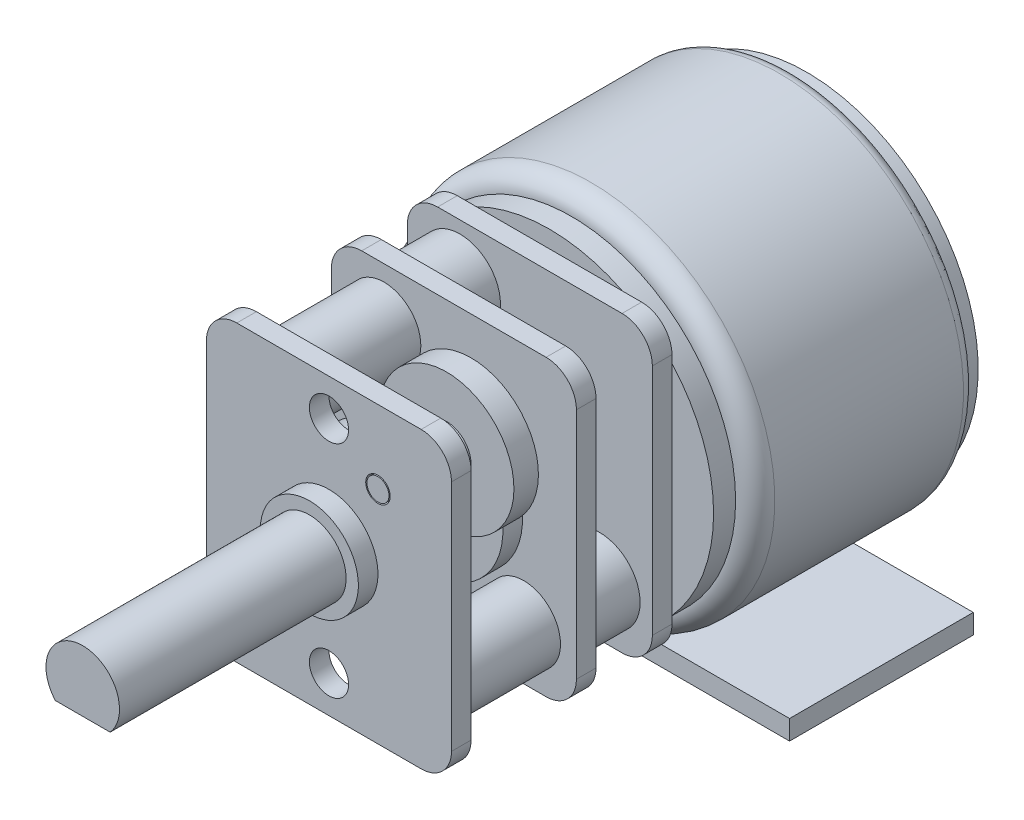
from build123d import *

# Parameters (mm, degrees)
SKETCH_2_OUTSIDE_W           = 24.52
SKETCH_2_OUTSIDE_H           = 24.52
CUT_EXTRUDE_1538_DEPTH       = 6.5
EXTRUDE_5_DEPTH              = 0.8
EXTRUDE_START                = 0.8
SKETCH_8_R                   = 0.8
SKETCH_8_R_2                 = 0.5
EXTRUDE_6_DEPTH              = 0.8
SKETCH_9_R                   = 1.65
EXTRUDE_7_DEPTH              = 2.3
EXTRUDE_8_DEPTH              = 0.8
EXTRUDE_9_REACH              = 21.113
SKETCH_11_R                  = 1.5
SKETCH_4_W                   = 11.5
SKETCH_4_H                   = 7.5
EXTRUDE_4965_DEPTH           = 0.8
SKETCH_5004_R                = 0.75
EXTRUDE_5452_DEPTH           = 0.7
EXTRUDE_5452_DRAFT           = 35
EXTRUDE_5452_PROFILE_2_DEPTH = 0.7
EXTRUDE_5452_PROFILE_2_DRAFT = 35
EXTRUDE_5452_PROFILE_3_DEPTH = 0.7
EXTRUDE_5452_PROFILE_3_DRAFT = 35
EXTRUDE_5452_PROFILE_4_DEPTH = 0.7
EXTRUDE_5452_PROFILE_4_DRAFT = 35
EXTRUDE_5452_PROFILE_5_DEPTH = 0.7
EXTRUDE_5452_PROFILE_5_DRAFT = 35
EXTRUDE_5452_PROFILE_6_DEPTH = 0.7
EXTRUDE_5452_PROFILE_6_DRAFT = 35
EXTRUDE_5452_PROFILE_7_DEPTH = 0.7
EXTRUDE_5452_PROFILE_7_DRAFT = 35
EXTRUDE_5452_PROFILE_8_DEPTH = 0.7
EXTRUDE_5452_PROFILE_8_DRAFT = 35
EXTRUDE_5761_DEPTH           = 0.01


with BuildPart() as part:
    # Эскиз1 → Motor (revolve)
    with BuildSketch(Plane(origin=(0, 0, 0), x_dir=(1, 0, 0), z_dir=(0, 1, 0))):
        with BuildLine():
            Line((0, 0), (-0.5, 0))
            ThreePointArc((-0.5, 0), (-0.676776695, -0.073223305), (-0.75, -0.25))
            Line((-0.75, -0.25), (-0.75, -0.5))
            Line((-0.75, -0.5), (-3, -0.5))
            Line((-3, -0.5), (-3, -1.5))
            Line((-3, -1.5), (-7, -1.5))
            Line((-7, -1.5), (-7, -2.1))
            ThreePointArc((-7, -2.1), (-7.353553391, -2.246446609), (-7.5, -2.6))
            Line((-7.5, -2.6), (-7.5, -10.3))
            ThreePointArc((-7.5, -10.3), (-7.265685425, -10.865685425), (-6.7, -11.1))
            Line((-6.7, -11.1), (-6.7, -12))
            Line((-6.7, -12), (-0.75, -12))
            Line((-0.75, -12), (0, -12))
            Line((0, -12), (0, 0))
        make_face()
        Polygon((0, -21), (-2, -21), (-2, -21.8), (-1.5, -21.8), (-1.5, -31.05), (0, -31.05), align=None)
    revolve(axis=Axis((0, 0, 0), (0, 0, 1)))

    # Эскиз2 outside → Cut-Extrude 1538 (cut)
    with BuildSketch(Plane.XY.offset(31.05)):
        Rectangle(SKETCH_2_OUTSIDE_W, SKETCH_2_OUTSIDE_H)
        with BuildLine():
            Line((-1.118033989, -1), (1.118033989, -1))
            ThreePointArc((1.118033989, -1), (0, 1.5), (-1.118033989, -1))
        make_face(mode=Mode.SUBTRACT)
    extrude(amount=-CUT_EXTRUDE_1538_DEPTH, mode=Mode.SUBTRACT)

    # Эскиз7 → Бобышка-Вытянуть5 (add)
    with BuildSketch(Plane.XY.offset(12)):
        with BuildLine():
            Line((3.762711015, 6), (-3.762711015, 6))
            ThreePointArc((-3.762711015, 6), (-4.637606447, 5.637606447), (-5, 4.762711015))
            Line((-5, 4.762711015), (-5, -4.762711015))
            ThreePointArc((-5, -4.762711015), (-4.637606447, -5.637606447), (-3.762711015, -6))
            Line((-3.762711015, -6), (3.762711015, -6))
            ThreePointArc((3.762711015, -6), (4.637606447, -5.637606447), (5, -4.762711015))
            Line((5, -4.762711015), (5, 4.762711015))
            ThreePointArc((5, 4.762711015), (4.637606447, 5.637606447), (3.762711015, 6))
        make_face()
    extrude(amount=EXTRUDE_5_DEPTH)

    # Эскиз8 → Бобышка-Вытянуть6 (add)
    with BuildSketch(Plane(origin=(0, 0, 21), x_dir=(-1, 0, 0), z_dir=(0, 0, -1)).offset(EXTRUDE_START)):
        with BuildLine():
            Line((3.762711015, 6), (-3.762711015, 6))
            ThreePointArc((-3.762711015, 6), (-4.637606447, 5.637606447), (-5, 4.762711015))
            Line((-5, 4.762711015), (-5, -4.762711015))
            ThreePointArc((-5, -4.762711015), (-4.637606447, -5.637606447), (-3.762711015, -6))
            Line((-3.762711015, -6), (3.762711015, -6))
            ThreePointArc((3.762711015, -6), (4.637606447, -5.637606447), (5, -4.762711015))
            Line((5, -4.762711015), (5, 4.762711015))
            ThreePointArc((5, 4.762711015), (4.637606447, 5.637606447), (3.762711015, 6))
        make_face()
        with Locations((0, -4.5)):
            Circle(SKETCH_8_R, mode=Mode.SUBTRACT)
        with Locations((0, 4.5)):
            Circle(SKETCH_8_R, mode=Mode.SUBTRACT)
        with Locations((2, -3)):
            Circle(SKETCH_8_R_2, mode=Mode.SUBTRACT)
        with Locations((-2, 3)):
            Circle(SKETCH_8_R_2, mode=Mode.SUBTRACT)
    extrude(amount=-EXTRUDE_6_DEPTH)

    # Эскиз9 → Бобышка-Вытянуть7 (add)
    with BuildSketch(Plane.XY.offset(12.8)):
        with Locations((2.85, -3.85)):
            Circle(SKETCH_9_R)
        with Locations((-2.85, 3.85)):
            Circle(SKETCH_9_R)
    extrude(amount=EXTRUDE_7_DEPTH)

    # Эскиз10 → Бобышка-Вытянуть8 (add)
    with BuildSketch(Plane.XY.offset(15.1)):
        with BuildLine():
            Line((3.762711015, 6), (-3.762711015, 6))
            ThreePointArc((-3.762711015, 6), (-4.637606447, 5.637606447), (-5, 4.762711015))
            Line((-5, 4.762711015), (-5, -0.262711015))
            ThreePointArc((-5, -0.262711015), (-4.637606447, -1.137606447), (-3.762711015, -1.5))
            Line((-3.762711015, -1.5), (-1.237288985, -1.5))
            ThreePointArc((-1.237288985, -1.5), (-0.362393553, -1.862393553), (0, -2.737288985))
            Line((0, -2.737288985), (0, -4.762711015))
            ThreePointArc((0, -4.762711015), (0.362393553, -5.637606447), (1.237288985, -6))
            Line((1.237288985, -6), (3.762711015, -6))
            ThreePointArc((3.762711015, -6), (4.637606447, -5.637606447), (5, -4.762711015))
            Line((5, -4.762711015), (5, 4.762711015))
            ThreePointArc((5, 4.762711015), (4.637606447, 5.637606447), (3.762711015, 6))
        make_face()
    extrude(amount=EXTRUDE_8_DEPTH)

    # Эскиз11 → Бобышка-Вытянуть9 (add, up to next)
    with BuildSketch(Plane.XY.offset(15.9), mode=Mode.PRIVATE) as extrude_9_sk1:
        with Locations(Location((2.85, -3.85, 0), (0, 0, 180))):
            Circle(SKETCH_11_R)
    extrude_9_tool1 = extrude(extrude_9_sk1.sketch, amount=EXTRUDE_9_REACH, mode=Mode.PRIVATE) - part.part
    # Эскиз11 → Бобышка-Вытянуть9 (add, up to next)
    with BuildSketch(Plane.XY.offset(15.9), mode=Mode.PRIVATE) as extrude_9_sk2:
        with Locations(Location((-2.85, 3.85, 0), (0, 0, 180))):
            Circle(SKETCH_11_R)
    extrude_9_tool2 = extrude(extrude_9_sk2.sketch, amount=EXTRUDE_9_REACH, mode=Mode.PRIVATE) - part.part
    add(extrude_9_tool1.solids().sort_by_distance((2.85, -3.85, 15.9))[0])
    add(extrude_9_tool2.solids().sort_by_distance((-2.85, 3.85, 15.9))[0])

    # Эскиз12 → Повернуть1 (revolve)
    with BuildSketch(Plane(origin=(0, 0, 0), x_dir=(1, 0, 0), z_dir=(0, 1, 0)), mode=Mode.PRIVATE) as revolve_1_sk:
        Polygon((0, -20.2), (-0.5, -20.2), (-0.5, -20), (-3, -20), (-3, -18.6), (-0.5, -18.6), (-0.5, -18.3), (-1.5, -18.3), (-1.5, -16.9), (-3, -16.9), (-3, -16.1), (-0.5, -16.1), (-0.5, -15.9), (0, -15.9), align=None)
        with BuildLine():
            Line((0, -12.8), (-0.75, -12.8))
            Line((-0.75, -12.8), (-0.75, -13))
            Line((-0.75, -13), (-1.5, -13))
            Line((-1.5, -13), (-1.5, -14))
            Line((-1.5, -14), (-0.75, -14))
            Line((-0.75, -14), (-0.75, -14.15))
            ThreePointArc((-0.75, -14.15), (-0.676776695, -14.326776695), (-0.5, -14.4))
            Line((-0.5, -14.4), (0, -14.4))
            Line((0, -14.4), (0, -12.8))
        make_face()
    revolve(revolve_1_sk.sketch.rotate(Axis((0, 0, 20.2), (0, 0, -1)), 180), axis=Axis((0, 0, 20.2), (0, 0, -1)))

    # Эскиз13 → Повернуть2 (revolve)
    with BuildSketch(Plane(origin=(0, 0, 0), x_dir=(0, 0, 1), z_dir=(-0.8320502943378438, 0.5547001962252291, 0)), mode=Mode.PRIVATE) as revolve_2_sk:
        Polygon((21, -3.605551275), (12.8, -3.605551275), (12.8, -3.304954271), (13, -3.304954271), (13, -0.855551275), (14, -0.855551275), (14, -2.605551275), (17.3, -2.605551275), (17.3, -3.155551275), (21, -3.155551275), align=None)
    revolve(revolve_2_sk.sketch.rotate(Axis((-2, -3, 21), (0, 0, 1)), 123.690067526), axis=Axis((-2, -3, 21), (0, 0, 1)))

    # Эскиз14 → Повернуть3 (revolve)
    with BuildSketch(Plane(origin=(0, 0, 0), x_dir=(0, 0, 1), z_dir=(-0.8320502943378438, 0.5547001962252291, 0)), mode=Mode.PRIVATE) as revolve_3_sk:
        Polygon((21, 3.605551275), (15.9, 3.605551275), (15.9, 3.105551275), (17.2, 3.105551275), (17.2, 0.855551275), (18.2, 0.855551275), (18.2, 2.605551275), (20, 2.605551275), (20, 3.155551275), (21, 3.155551275), align=None)
    revolve(revolve_3_sk.sketch.rotate(Axis((2, 3, 21), (0, 0, 1)), 303.690067526), axis=Axis((2, 3, 21), (0, 0, 1)))


with BuildPart() as body_2:
    # Эскиз4 → Extrude 4965 (new body)
    with BuildSketch(Plane(origin=(0, -7.5, 0), x_dir=(-1, 0, 0), z_dir=(0, -1, 0))):
        with Locations((-2.25, -6.45)):
            Rectangle(SKETCH_4_W, SKETCH_4_H)
    extrude(amount=EXTRUDE_4965_DEPTH)


with BuildPart() as extrude_5452_tool:
    # Sketch 5004 → Extrude 5452 (with draft: the straight prism first)
    with BuildSketch(Plane.XZ.offset(8.3)):
        with Locations((-2.25, 5.7)):
            Circle(SKETCH_5004_R)
    extrude(amount=EXTRUDE_5452_DEPTH)
    # Extrude 5452: the draft: its side faces are tilted about the plane it starts from
    extrude_5452_sides = [extrude_5452_tool.faces().sort_by_distance(p)[0] for p in [
        (-3, -8.65, 5.7),
    ]]
    draft(extrude_5452_sides, Plane.XZ.offset(8.3), EXTRUDE_5452_DRAFT)


with BuildPart() as body_2_1:
    add(body_2.part)

    # Extrude 5452: add extrude_5452_tool
    add(extrude_5452_tool.part)


with BuildPart() as extrude_5452_profile_2_tool:
    # Sketch 5004 → Extrude 5452 profile 2 (with draft: the straight prism first)
    with BuildSketch(Plane.XZ.offset(8.3)):
        with Locations((-0.75, 7.2)):
            Circle(SKETCH_5004_R)
    extrude(amount=EXTRUDE_5452_PROFILE_2_DEPTH)
    # Extrude 5452 profile 2: the draft: its side faces are tilted about the plane it starts from
    extrude_5452_profile_2_sides = [extrude_5452_profile_2_tool.faces().sort_by_distance(p)[0] for p in [
        (-1.5, -8.65, 7.2),
    ]]
    draft(extrude_5452_profile_2_sides, Plane.XZ.offset(8.3), EXTRUDE_5452_PROFILE_2_DRAFT)


with BuildPart() as body_2_2:
    add(body_2_1.part)

    # Extrude 5452 profile 2: add extrude_5452_profile_2_tool
    add(extrude_5452_profile_2_tool.part)


with BuildPart() as extrude_5452_profile_3_tool:
    # Sketch 5004 → Extrude 5452 profile 3 (with draft: the straight prism first)
    with BuildSketch(Plane.XZ.offset(8.3)):
        with Locations((0.75, 5.7)):
            Circle(SKETCH_5004_R)
    extrude(amount=EXTRUDE_5452_PROFILE_3_DEPTH)
    # Extrude 5452 profile 3: the draft: its side faces are tilted about the plane it starts from
    extrude_5452_profile_3_sides = [extrude_5452_profile_3_tool.faces().sort_by_distance(p)[0] for p in [
        (0, -8.65, 5.7),
    ]]
    draft(extrude_5452_profile_3_sides, Plane.XZ.offset(8.3), EXTRUDE_5452_PROFILE_3_DRAFT)


with BuildPart() as body_2_3:
    add(body_2_2.part)

    # Extrude 5452 profile 3: add extrude_5452_profile_3_tool
    add(extrude_5452_profile_3_tool.part)


with BuildPart() as extrude_5452_profile_4_tool:
    # Sketch 5004 → Extrude 5452 profile 4 (with draft: the straight prism first)
    with BuildSketch(Plane.XZ.offset(8.3)):
        with Locations((2.25, 7.2)):
            Circle(SKETCH_5004_R)
    extrude(amount=EXTRUDE_5452_PROFILE_4_DEPTH)
    # Extrude 5452 profile 4: the draft: its side faces are tilted about the plane it starts from
    extrude_5452_profile_4_sides = [extrude_5452_profile_4_tool.faces().sort_by_distance(p)[0] for p in [
        (1.5, -8.65, 7.2),
    ]]
    draft(extrude_5452_profile_4_sides, Plane.XZ.offset(8.3), EXTRUDE_5452_PROFILE_4_DRAFT)


with BuildPart() as body_2_4:
    add(body_2_3.part)

    # Extrude 5452 profile 4: add extrude_5452_profile_4_tool
    add(extrude_5452_profile_4_tool.part)


with BuildPart() as extrude_5452_profile_5_tool:
    # Sketch 5004 → Extrude 5452 profile 5 (with draft: the straight prism first)
    with BuildSketch(Plane.XZ.offset(8.3)):
        with Locations((7, 3.7)):
            Circle(SKETCH_5004_R)
    extrude(amount=EXTRUDE_5452_PROFILE_5_DEPTH)
    # Extrude 5452 profile 5: the draft: its side faces are tilted about the plane it starts from
    extrude_5452_profile_5_sides = [extrude_5452_profile_5_tool.faces().sort_by_distance(p)[0] for p in [
        (6.25, -8.65, 3.7),
    ]]
    draft(extrude_5452_profile_5_sides, Plane.XZ.offset(8.3), EXTRUDE_5452_PROFILE_5_DRAFT)


with BuildPart() as body_2_5:
    add(body_2_4.part)

    # Extrude 5452 profile 5: add extrude_5452_profile_5_tool
    add(extrude_5452_profile_5_tool.part)


with BuildPart() as extrude_5452_profile_6_tool:
    # Sketch 5004 → Extrude 5452 profile 6 (with draft: the straight prism first)
    with BuildSketch(Plane.XZ.offset(8.3)):
        with Locations((7, 5.533333333)):
            Circle(SKETCH_5004_R)
    extrude(amount=EXTRUDE_5452_PROFILE_6_DEPTH)
    # Extrude 5452 profile 6: the draft: its side faces are tilted about the plane it starts from
    extrude_5452_profile_6_sides = [extrude_5452_profile_6_tool.faces().sort_by_distance(p)[0] for p in [
        (6.25, -8.65, 5.533333333),
    ]]
    draft(extrude_5452_profile_6_sides, Plane.XZ.offset(8.3), EXTRUDE_5452_PROFILE_6_DRAFT)


with BuildPart() as body_2_6:
    add(body_2_5.part)

    # Extrude 5452 profile 6: add extrude_5452_profile_6_tool
    add(extrude_5452_profile_6_tool.part)


with BuildPart() as extrude_5452_profile_7_tool:
    # Sketch 5004 → Extrude 5452 profile 7 (with draft: the straight prism first)
    with BuildSketch(Plane.XZ.offset(8.3)):
        with Locations((7, 7.366666667)):
            Circle(SKETCH_5004_R)
    extrude(amount=EXTRUDE_5452_PROFILE_7_DEPTH)
    # Extrude 5452 profile 7: the draft: its side faces are tilted about the plane it starts from
    extrude_5452_profile_7_sides = [extrude_5452_profile_7_tool.faces().sort_by_distance(p)[0] for p in [
        (6.25, -8.65, 7.366666667),
    ]]
    draft(extrude_5452_profile_7_sides, Plane.XZ.offset(8.3), EXTRUDE_5452_PROFILE_7_DRAFT)


with BuildPart() as body_2_7:
    add(body_2_6.part)

    # Extrude 5452 profile 7: add extrude_5452_profile_7_tool
    add(extrude_5452_profile_7_tool.part)


with BuildPart() as extrude_5452_profile_8_tool:
    # Sketch 5004 → Extrude 5452 profile 8 (with draft: the straight prism first)
    with BuildSketch(Plane.XZ.offset(8.3)):
        with Locations((7, 9.2)):
            Circle(SKETCH_5004_R)
    extrude(amount=EXTRUDE_5452_PROFILE_8_DEPTH)
    # Extrude 5452 profile 8: the draft: its side faces are tilted about the plane it starts from
    extrude_5452_profile_8_sides = [extrude_5452_profile_8_tool.faces().sort_by_distance(p)[0] for p in [
        (6.25, -8.65, 9.2),
    ]]
    draft(extrude_5452_profile_8_sides, Plane.XZ.offset(8.3), EXTRUDE_5452_PROFILE_8_DRAFT)


with BuildPart() as body_2_8:
    add(body_2_7.part)

    # Extrude 5452 profile 8: add extrude_5452_profile_8_tool
    add(extrude_5452_profile_8_tool.part)

    # Эскиз6 → Extrude 5761 (add)
    # profile 1 of 16: a face of its own
    with BuildSketch(Plane.XZ.offset(8.3)):
        with BuildLine():
            Line((5.183226347, 9.305128205), (5.183226347, 9.228846154))
            add(Edge.make_bspline(
                [(5.183226347, 9.228846154), (5.173106274, 9.22934332), (5.153230721, 9.23031974), (5.124252058, 9.234892324), (5.096553035, 9.241435109), (5.070356056, 9.250685891), (5.045429488, 9.262174558), (5.021872342, 9.27595185), (4.999774482, 9.292270357), (4.979340763, 9.310777707), (4.96059521, 9.330878662), (4.944407508, 9.352567247), (4.930730359, 9.375358182), (4.919296343, 9.399182322), (4.910713809, 9.424308459), (4.904345697, 9.450508582), (4.900514298, 9.4778978), (4.900102465, 9.496558949), (4.899893013, 9.506049679)],
                knots=[0, 0, 0, 0, 1.10065271, 2.161652631, 3.183658789, 4.190468796, 5.17591951, 6.163126047, 7.15150782, 8.156236427, 9.156009102, 10.134482811, 11.092018607, 12.041330605, 13.001268258, 13.972401359, 14.968799086, 16, 16, 16, 16], degree=3))
            add(Edge.make_bspline(
                [(4.899893013, 9.506049679), (4.900109439, 9.515370725), (4.900534708, 9.533686246), (4.904241722, 9.560406313), (4.909922389, 9.585903666), (4.918340243, 9.609889343), (4.928902809, 9.632609504), (4.942038744, 9.653782836), (4.957126498, 9.673921332), (4.974923245, 9.69203663), (4.993912419, 9.708677717), (5.014192696, 9.723021328), (5.035163128, 9.735374158), (5.056987523, 9.745484564), (5.079736952, 9.753148701), (5.10319331, 9.758827092), (5.127627297, 9.762073168), (5.144167936, 9.762568621), (5.152577308, 9.762820513)],
                knots=[0, 0, 0, 0, 1.111674182, 2.184400057, 3.212814286, 4.223731311, 5.211378316, 6.196328225, 7.191884489, 8.207283132, 9.220262353, 10.201199469, 11.166417575, 12.120932471, 13.06540007, 14.026332106, 14.996573967, 16, 16, 16, 16], degree=3))
            add(Edge.make_bspline(
                [(5.152577308, 9.762820513), (5.164416063, 9.762409285), (5.187885819, 9.761594047), (5.222375218, 9.75462065), (5.255790478, 9.743728994), (5.282684739, 9.730616512), (5.304353679, 9.717384889), (5.322203622, 9.705473201), (5.341418154, 9.691449296), (5.362075046, 9.675432988), (5.383903778, 9.657148454), (5.407349714, 9.637070722), (5.431979324, 9.614681279), (5.448812639, 9.598980897), (5.457535241, 9.590845353)],
                knots=[0, 0, 0, 0, 1.184416499, 2.348048165, 3.509039915, 4.696071444, 5.333504901, 6.05069495, 6.844171097, 7.714965912, 8.667477798, 9.695072654, 10.805644396, 12, 12, 12, 12], degree=3))
            Line((5.457535241, 9.590845353), (5.684508398, 9.37817508))
            Line((5.684508398, 9.37817508), (5.684508398, 9.773717949))
            Line((5.684508398, 9.773717949), (5.771687885, 9.773717949))
            Line((5.771687885, 9.773717949), (5.771687885, 9.196153846))
            Line((5.771687885, 9.196153846), (5.419905033, 9.525801282))
            add(Edge.make_bspline(
                [(5.419905033, 9.525801282), (5.411526873, 9.533827197), (5.395434141, 9.549243338), (5.371939423, 9.571047678), (5.350143106, 9.590631433), (5.330086372, 9.608121371), (5.311475849, 9.623138079), (5.294914278, 9.636464193), (5.279673911, 9.647141551), (5.262008334, 9.658729575), (5.240439628, 9.669952971), (5.214081446, 9.6795974), (5.186947685, 9.685478149), (5.168611476, 9.686183609), (5.159388206, 9.686538462)],
                knots=[0, 0, 0, 0, 1.329631726, 2.553950428, 3.673215718, 4.687767853, 5.603093632, 6.413772471, 7.123043292, 7.734684054, 8.834405432, 9.900288307, 10.943827018, 12, 12, 12, 12], degree=3))
            add(Edge.make_bspline(
                [(5.159388206, 9.686538462), (5.153588438, 9.686384067), (5.142158208, 9.686079785), (5.125399667, 9.683394344), (5.109233926, 9.679336078), (5.093611262, 9.673520801), (5.078688746, 9.665844879), (5.064448215, 9.656501344), (5.050680895, 9.6457209), (5.037772237, 9.633249877), (5.025949658, 9.619549937), (5.015476666, 9.605077047), (5.006724311, 9.589764879), (4.999549462, 9.573677992), (4.993921155, 9.556861236), (4.990021214, 9.539282083), (4.987572611, 9.520989108), (4.987241312, 9.508498116), (4.987072501, 9.502133413)],
                knots=[0, 0, 0, 0, 0.991446411, 1.95395049, 2.89581595, 3.838931463, 4.798493298, 5.75982156, 6.748411868, 7.785213223, 8.824556874, 9.840280684, 10.836137867, 11.835679398, 12.848801643, 13.863922112, 14.911575587, 16, 16, 16, 16], degree=3))
            add(Edge.make_bspline(
                [(4.987072501, 9.502133413), (4.987239299, 9.495484543), (4.987566864, 9.482427259), (4.990048006, 9.463296967), (4.993809418, 9.444921487), (4.999783361, 9.427574998), (5.006841872, 9.410881872), (5.015808949, 9.395198482), (5.026228891, 9.380264435), (5.03831124, 9.366325367), (5.051886632, 9.353594562), (5.066847651, 9.342251598), (5.08308659, 9.332405907), (5.1005368, 9.323803635), (5.119372022, 9.316820921), (5.139521114, 9.311484355), (5.160897794, 9.307261899), (5.175659878, 9.305851249), (5.183226347, 9.305128205)],
                knots=[0, 0, 0, 0, 1.030878251, 2.024474673, 2.987898669, 3.934362936, 4.864849709, 5.795128259, 6.730474222, 7.685293701, 8.650606017, 9.611896181, 10.591709709, 11.591680886, 12.625074257, 13.701333388, 14.821793024, 16, 16, 16, 16], degree=3))
        make_face()
    # profile 2 of 16: a face of its own
    with BuildSketch(Plane.XZ.offset(8.3)):
        Polygon((4.921687885, 8.749358974), (5.771687885, 9.141666667), (5.771687885, 9.05874399), (5.499251988, 8.933082933), (5.499251988, 8.54775641), (5.771687885, 8.418519631), (5.771687885, 8.33525641), (4.921687885, 8.738461538), align=None)
        Polygon((5.087362965, 8.743058894), (5.412072501, 8.589132612), (5.412072501, 8.892898638), align=None, mode=Mode.SUBTRACT)
    # profile 3 of 16: a face of its own
    with BuildSketch(Plane.XZ.offset(8.3)):
        Polygon((4.921687885, 7.524248798), (4.921687885, 7.681410256), (5.771687885, 7.681410256), (5.771687885, 7.605128205), (5.008867372, 7.605128205), (5.008867372, 7.474358974), align=None)
    # profile 4 of 16: a face of its own
    with BuildSketch(Plane.XZ.offset(8.3)):
        Polygon((4.921687885, 6.896794872), (5.771687885, 7.289102564), (5.771687885, 7.206179888), (5.499251988, 7.08051883), (5.499251988, 6.695192308), (5.771687885, 6.565955529), (5.771687885, 6.482692308), (4.921687885, 6.885897436), align=None)
        Polygon((5.087362965, 6.890494792), (5.412072501, 6.73656851), (5.412072501, 7.040334535), align=None, mode=Mode.SUBTRACT)
    # profile 5 of 16: a face of its own
    with BuildSketch(Plane.XZ.offset(8.3)):
        with BuildLine():
            Line((5.183226347, 5.6), (5.183226347, 5.523717949))
            add(Edge.make_bspline(
                [(5.183226347, 5.523717949), (5.173106274, 5.524215114), (5.153230721, 5.525191535), (5.124252058, 5.529764119), (5.096553035, 5.536306904), (5.070356056, 5.545557685), (5.045429488, 5.557046353), (5.021872342, 5.570823645), (4.999774482, 5.587142152), (4.979340763, 5.605649501), (4.96059521, 5.625750457), (4.944407508, 5.647439042), (4.930730359, 5.670229977), (4.919296343, 5.694054117), (4.910713809, 5.719180254), (4.904345697, 5.745380376), (4.900514298, 5.772769595), (4.900102465, 5.791430743), (4.899893013, 5.800921474)],
                knots=[0, 0, 0, 0, 1.10065271, 2.161652631, 3.183658789, 4.190468796, 5.17591951, 6.163126047, 7.15150782, 8.156236427, 9.156009102, 10.134482811, 11.092018607, 12.041330605, 13.001268258, 13.972401359, 14.968799086, 16, 16, 16, 16], degree=3))
            add(Edge.make_bspline(
                [(4.899893013, 5.800921474), (4.900109439, 5.81024252), (4.900534708, 5.828558041), (4.904241722, 5.855278108), (4.909922389, 5.880775461), (4.918340243, 5.904761137), (4.928902809, 5.927481298), (4.942038744, 5.94865463), (4.957126498, 5.968793127), (4.974923245, 5.986908425), (4.993912419, 6.003549512), (5.014192696, 6.017893123), (5.035163128, 6.030245953), (5.056987523, 6.040356359), (5.079736952, 6.048020496), (5.10319331, 6.053698887), (5.127627297, 6.056944963), (5.144167936, 6.057440416), (5.152577308, 6.057692308)],
                knots=[0, 0, 0, 0, 1.111674182, 2.184400057, 3.212814286, 4.223731311, 5.211378316, 6.196328225, 7.191884489, 8.207283132, 9.220262353, 10.201199469, 11.166417575, 12.120932471, 13.06540007, 14.026332106, 14.996573967, 16, 16, 16, 16], degree=3))
            add(Edge.make_bspline(
                [(5.152577308, 6.057692308), (5.164416063, 6.05728108), (5.187885819, 6.056465842), (5.222375218, 6.049492445), (5.255790478, 6.038600789), (5.282684739, 6.025488307), (5.304353679, 6.012256684), (5.322203622, 6.000344996), (5.341418154, 5.986321091), (5.362075046, 5.970304783), (5.383903778, 5.952020248), (5.407349714, 5.931942517), (5.431979324, 5.909553074), (5.448812639, 5.893852692), (5.457535241, 5.885717147)],
                knots=[0, 0, 0, 0, 1.184416499, 2.348048165, 3.509039915, 4.696071444, 5.333504901, 6.05069495, 6.844171097, 7.714965912, 8.667477798, 9.695072654, 10.805644396, 12, 12, 12, 12], degree=3))
            Line((5.457535241, 5.885717147), (5.684508398, 5.673046875))
            Line((5.684508398, 5.673046875), (5.684508398, 6.068589744))
            Line((5.684508398, 6.068589744), (5.771687885, 6.068589744))
            Line((5.771687885, 6.068589744), (5.771687885, 5.491025641))
            Line((5.771687885, 5.491025641), (5.419905033, 5.820673077))
            add(Edge.make_bspline(
                [(5.419905033, 5.820673077), (5.411526873, 5.828698992), (5.395434141, 5.844115133), (5.371939423, 5.865919473), (5.350143106, 5.885503228), (5.330086372, 5.902993166), (5.311475849, 5.918009874), (5.294914278, 5.931335988), (5.279673911, 5.942013346), (5.262008334, 5.95360137), (5.240439628, 5.964824766), (5.214081446, 5.974469195), (5.186947685, 5.980349944), (5.168611476, 5.981055404), (5.159388206, 5.981410256)],
                knots=[0, 0, 0, 0, 1.329631726, 2.553950428, 3.673215718, 4.687767853, 5.603093632, 6.413772471, 7.123043292, 7.734684054, 8.834405432, 9.900288307, 10.943827018, 12, 12, 12, 12], degree=3))
            add(Edge.make_bspline(
                [(5.159388206, 5.981410256), (5.153588438, 5.981255862), (5.142158208, 5.98095158), (5.125399667, 5.978266139), (5.109233926, 5.974207873), (5.093611262, 5.968392596), (5.078688746, 5.960716674), (5.064448215, 5.951373139), (5.050680895, 5.940592695), (5.037772237, 5.928121672), (5.025949658, 5.914421732), (5.015476666, 5.899948842), (5.006724311, 5.884636674), (4.999549462, 5.868549787), (4.993921155, 5.85173303), (4.990021214, 5.834153878), (4.987572611, 5.815860903), (4.987241312, 5.803369911), (4.987072501, 5.797005208)],
                knots=[0, 0, 0, 0, 0.991446411, 1.95395049, 2.89581595, 3.838931463, 4.798493298, 5.75982156, 6.748411868, 7.785213223, 8.824556874, 9.840280684, 10.836137867, 11.835679398, 12.848801643, 13.863922112, 14.911575587, 16, 16, 16, 16], degree=3))
            add(Edge.make_bspline(
                [(4.987072501, 5.797005208), (4.987239299, 5.790356338), (4.987566864, 5.777299054), (4.990048006, 5.758168762), (4.993809418, 5.739793282), (4.999783361, 5.722446793), (5.006841872, 5.705753667), (5.015808949, 5.690070277), (5.026228891, 5.67513623), (5.03831124, 5.661197162), (5.051886632, 5.648466356), (5.066847651, 5.637123393), (5.08308659, 5.627277702), (5.1005368, 5.61867543), (5.119372022, 5.611692716), (5.139521114, 5.606356149), (5.160897794, 5.602133694), (5.175659878, 5.600723044), (5.183226347, 5.6)],
                knots=[0, 0, 0, 0, 1.030878251, 2.024474673, 2.987898669, 3.934362936, 4.864849709, 5.795128259, 6.730474222, 7.685293701, 8.650606017, 9.611896181, 10.591709709, 11.591680886, 12.625074257, 13.701333388, 14.821793024, 16, 16, 16, 16], degree=3))
        make_face()
    # profile 6 of 16: a face of its own
    with BuildSketch(Plane.XZ.offset(8.3)):
        with BuildLine():
            Line((4.921687885, 4.891666667), (4.921687885, 5.057512019))
            add(Edge.make_bspline(
                [(4.921687885, 5.057512019), (4.921729896, 5.065630492), (4.921811322, 5.081366113), (4.9231035, 5.104246237), (4.924821328, 5.125684119), (4.927702893, 5.145641874), (4.930690696, 5.164249365), (4.935076075, 5.181317687), (4.939919886, 5.196989808), (4.947372746, 5.215808817), (4.958947132, 5.237161562), (4.976113047, 5.260111768), (4.996693592, 5.280061486), (5.020146747, 5.297024661), (5.045947875, 5.310637969), (5.073541857, 5.320362002), (5.102464456, 5.326609091), (5.122293572, 5.327243488), (5.132314888, 5.327564103)],
                knots=[0, 0, 0, 0, 1.00128172, 1.940733171, 2.826250472, 3.653024905, 4.427672124, 5.149348099, 5.824709082, 6.450061444, 7.643590664, 8.808605388, 9.972104426, 11.165284501, 12.367876273, 13.557044126, 14.765369432, 16, 16, 16, 16], degree=3))
            add(Edge.make_bspline(
                [(5.132314888, 5.327564103), (5.141701525, 5.327297054), (5.160147151, 5.326772279), (5.187079484, 5.321815329), (5.212690558, 5.313947941), (5.236958454, 5.303074894), (5.259431423, 5.28906558), (5.28003985, 5.272280453), (5.29800485, 5.252113258), (5.308044519, 5.23699586), (5.313144215, 5.229316907)],
                knots=[0, 0, 0, 0, 1.044641374, 2.052818814, 3.038628718, 4.023282556, 5.005660861, 5.98021751, 6.974042014, 8, 8, 8, 8], degree=3))
            add(Edge.make_bspline(
                [(5.313144215, 5.229316907), (5.31685263, 5.238972078), (5.323947745, 5.257444813), (5.336472213, 5.282880656), (5.350143866, 5.304715331), (5.364843335, 5.323375369), (5.380921481, 5.33925023), (5.39850893, 5.352998779), (5.417591286, 5.364884666), (5.438098413, 5.374999475), (5.459856464, 5.382944783), (5.482599686, 5.388784474), (5.506240892, 5.392238779), (5.522284288, 5.392709999), (5.530411844, 5.392948718)],
                knots=[0, 0, 0, 0, 1.272586185, 2.434772614, 3.483318042, 4.437947805, 5.351807173, 6.25737843, 7.180033415, 8.1141739, 9.066731021, 10.025721652, 10.999834114, 12, 12, 12, 12], degree=3))
            add(Edge.make_bspline(
                [(5.530411844, 5.392948718), (5.538709546, 5.392711536), (5.555035509, 5.392244873), (5.579018416, 5.388800425), (5.601939819, 5.382972364), (5.623937413, 5.374930785), (5.644965078, 5.36450756), (5.664946637, 5.351639506), (5.683923663, 5.336507263), (5.701929646, 5.319405383), (5.718405686, 5.300346676), (5.732569525, 5.279342753), (5.744748407, 5.256969021), (5.754664019, 5.232939453), (5.762313907, 5.20731539), (5.767643775, 5.180111092), (5.771241058, 5.151371361), (5.771536416, 5.131648848), (5.771687885, 5.121534455)],
                knots=[0, 0, 0, 0, 0.978680899, 1.925582087, 2.851223405, 3.764209995, 4.683484765, 5.614004905, 6.562443559, 7.542772147, 8.539900013, 9.527881485, 10.525548727, 11.540192123, 12.58875426, 13.674701727, 14.807505862, 16, 16, 16, 16], degree=3))
            Line((5.771687885, 5.121534455), (5.771687885, 4.891666667))
            Line((5.771687885, 4.891666667), (4.921687885, 4.891666667))
        make_face()
        with BuildLine():
            Line((5.008867372, 4.967948718), (5.28130327, 4.967948718))
            Line((5.28130327, 4.967948718), (5.28130327, 5.019200721))
            add(Edge.make_bspline(
                [(5.28130327, 5.019200721), (5.281206146, 5.026692571), (5.281018482, 5.041168353), (5.280480913, 5.062131756), (5.278975675, 5.08159069), (5.277470866, 5.099511561), (5.275024188, 5.115866163), (5.272111792, 5.130618217), (5.269031732, 5.14399939), (5.263793117, 5.159430062), (5.256053503, 5.176935943), (5.244030592, 5.195585728), (5.22972181, 5.212103369), (5.213057021, 5.225884323), (5.194906136, 5.237262557), (5.175428501, 5.245233368), (5.155016081, 5.250547271), (5.140975869, 5.251034615), (5.13384734, 5.251282051)],
                knots=[0, 0, 0, 0, 1.156917035, 2.235399477, 3.236897345, 4.169954739, 5.01148057, 5.788325709, 6.491867502, 7.129259015, 8.302032419, 9.437271567, 10.542795419, 11.662606952, 12.764338259, 13.836858145, 14.901724648, 16, 16, 16, 16], degree=3))
            add(Edge.make_bspline(
                [(5.13384734, 5.251282051), (5.129129035, 5.251156419), (5.119873562, 5.250909976), (5.106337387, 5.248818291), (5.093618347, 5.245429205), (5.081594372, 5.240839469), (5.070564286, 5.234569208), (5.060001043, 5.227301152), (5.05053733, 5.218327706), (5.041717527, 5.208186914), (5.033823833, 5.19658404), (5.027285131, 5.183269099), (5.021358894, 5.168586302), (5.016971877, 5.152137298), (5.013114184, 5.134262916), (5.010690369, 5.114721129), (5.009130621, 5.09363577), (5.008957079, 5.079026264), (5.008867372, 5.071474359)],
                knots=[0, 0, 0, 0, 0.911708768, 1.788416306, 2.640049961, 3.452993646, 4.268229297, 5.087074648, 5.92553149, 6.781184137, 7.681934069, 8.628939405, 9.643570426, 10.73771997, 11.914765019, 13.176320755, 14.540391495, 16, 16, 16, 16], degree=3))
            Line((5.008867372, 5.071474359), (5.008867372, 4.967948718))
        make_face(mode=Mode.SUBTRACT)
        with BuildLine():
            Line((5.368482757, 4.967948718), (5.684508398, 4.967948718))
            Line((5.684508398, 4.967948718), (5.684508398, 5.076582532))
            add(Edge.make_bspline(
                [(5.684508398, 5.076582532), (5.684405935, 5.084357744), (5.684208452, 5.099343439), (5.683745313, 5.120997247), (5.681993329, 5.141014608), (5.680377131, 5.159458668), (5.677613502, 5.176280477), (5.675005355, 5.19160943), (5.671133746, 5.20519389), (5.665812676, 5.221090852), (5.657294304, 5.23885998), (5.644849042, 5.25827844), (5.629489668, 5.275211035), (5.612021289, 5.289746088), (5.593080235, 5.301741044), (5.572914124, 5.31034856), (5.55191515, 5.315697578), (5.537594042, 5.316342987), (5.530411844, 5.316666667)],
                knots=[0, 0, 0, 0, 1.160376723, 2.23647316, 3.230273494, 4.158083346, 4.997711197, 5.773399541, 6.476071462, 7.102777513, 8.27340052, 9.405620712, 10.53304798, 11.669441455, 12.787990954, 13.865552736, 14.929550474, 16, 16, 16, 16], degree=3))
            add(Edge.make_bspline(
                [(5.530411844, 5.316666667), (5.525920507, 5.316599818), (5.51701028, 5.316467199), (5.503917848, 5.314458056), (5.491229211, 5.311551463), (5.478891494, 5.307723396), (5.467112139, 5.302371964), (5.455845971, 5.295811558), (5.444866039, 5.288302007), (5.430805284, 5.276716191), (5.414806095, 5.259618481), (5.39933539, 5.235320728), (5.386657297, 5.207845865), (5.381297542, 5.187872045), (5.378528831, 5.177554087)],
                knots=[0, 0, 0, 0, 0.723302347, 1.434937762, 2.129609326, 2.821140842, 3.513216847, 4.209993937, 4.920569932, 5.655069131, 7.14393391, 8.6716197, 10.280644748, 12, 12, 12, 12], degree=3))
            add(Edge.make_bspline(
                [(5.378528831, 5.177554087), (5.377689739, 5.173418449), (5.375870415, 5.164451534), (5.373949973, 5.149829693), (5.372239029, 5.133136696), (5.370973463, 5.114333997), (5.369665302, 5.093397807), (5.36915656, 5.070283413), (5.368549597, 5.045085208), (5.368505607, 5.027601346), (5.368482757, 5.018519631)],
                knots=[0, 0, 0, 0, 0.634451884, 1.375622551, 2.216452059, 3.157844607, 4.20941857, 5.370758133, 6.634282058, 8, 8, 8, 8], degree=3))
            Line((5.368482757, 5.018519631), (5.368482757, 4.967948718))
        make_face(mode=Mode.SUBTRACT)
    # profile 7 of 16: a face of its own
    with BuildSketch(Plane.XZ.offset(8.3)):
        Polygon((4.921687885, 4.015274439), (4.921687885, 4.172435897), (5.771687885, 4.172435897), (5.771687885, 4.096153846), (5.008867372, 4.096153846), (5.008867372, 3.965384615), align=None)
    # profile 8 of 16: a face of its own
    with BuildSketch(Plane.XZ.offset(8.3)):
        with BuildLine():
            Line((4.921687885, 3.23525641), (4.921687885, 3.401101763))
            add(Edge.make_bspline(
                [(4.921687885, 3.401101763), (4.921729896, 3.409220236), (4.921811322, 3.424955856), (4.9231035, 3.447835981), (4.924821328, 3.469273862), (4.927702893, 3.489231618), (4.930690696, 3.507839109), (4.935076075, 3.52490743), (4.939919886, 3.540579551), (4.947372746, 3.559398561), (4.958947132, 3.580751306), (4.976113047, 3.603701511), (4.996693592, 3.62365123), (5.020146747, 3.640614404), (5.045947875, 3.654227713), (5.073541857, 3.663951745), (5.102464456, 3.670198834), (5.122293572, 3.670833232), (5.132314888, 3.671153846)],
                knots=[0, 0, 0, 0, 1.00128172, 1.940733171, 2.826250472, 3.653024905, 4.427672124, 5.149348099, 5.824709082, 6.450061444, 7.643590664, 8.808605388, 9.972104426, 11.165284501, 12.367876273, 13.557044126, 14.765369432, 16, 16, 16, 16], degree=3))
            add(Edge.make_bspline(
                [(5.132314888, 3.671153846), (5.141701525, 3.670886798), (5.160147151, 3.670362023), (5.187079484, 3.665405073), (5.212690558, 3.657537685), (5.236958454, 3.646664637), (5.259431423, 3.632655324), (5.28003985, 3.615870197), (5.29800485, 3.595703001), (5.308044519, 3.580585604), (5.313144215, 3.572906651)],
                knots=[0, 0, 0, 0, 1.044641374, 2.052818814, 3.038628718, 4.023282556, 5.005660861, 5.98021751, 6.974042014, 8, 8, 8, 8], degree=3))
            add(Edge.make_bspline(
                [(5.313144215, 3.572906651), (5.31685263, 3.582561822), (5.323947745, 3.601034557), (5.336472213, 3.626470399), (5.350143866, 3.648305075), (5.364843335, 3.666965112), (5.380921481, 3.682839974), (5.39850893, 3.696588522), (5.417591286, 3.70847441), (5.438098413, 3.718589218), (5.459856464, 3.726534527), (5.482599686, 3.732374218), (5.506240892, 3.735828522), (5.522284288, 3.736299742), (5.530411844, 3.736538462)],
                knots=[0, 0, 0, 0, 1.272586185, 2.434772614, 3.483318042, 4.437947805, 5.351807173, 6.25737843, 7.180033415, 8.1141739, 9.066731021, 10.025721652, 10.999834114, 12, 12, 12, 12], degree=3))
            add(Edge.make_bspline(
                [(5.530411844, 3.736538462), (5.538709546, 3.736301279), (5.555035509, 3.735834617), (5.579018416, 3.732390169), (5.601939819, 3.726562108), (5.623937413, 3.718520529), (5.644965078, 3.708097304), (5.664946637, 3.695229249), (5.683923663, 3.680097007), (5.701929646, 3.662995127), (5.718405686, 3.643936419), (5.732569525, 3.622932497), (5.744748407, 3.600558765), (5.754664019, 3.576529196), (5.762313907, 3.550905134), (5.767643775, 3.523700836), (5.771241058, 3.494961104), (5.771536416, 3.475238592), (5.771687885, 3.465124199)],
                knots=[0, 0, 0, 0, 0.978680899, 1.925582087, 2.851223405, 3.764209995, 4.683484765, 5.614004905, 6.562443559, 7.542772147, 8.539900013, 9.527881485, 10.525548727, 11.540192123, 12.58875426, 13.674701727, 14.807505862, 16, 16, 16, 16], degree=3))
            Line((5.771687885, 3.465124199), (5.771687885, 3.23525641))
            Line((5.771687885, 3.23525641), (4.921687885, 3.23525641))
        make_face()
        with BuildLine():
            Line((5.008867372, 3.311538462), (5.28130327, 3.311538462))
            Line((5.28130327, 3.311538462), (5.28130327, 3.362790465))
            add(Edge.make_bspline(
                [(5.28130327, 3.362790465), (5.281206146, 3.370282315), (5.281018482, 3.384758097), (5.280480913, 3.4057215), (5.278975675, 3.425180434), (5.277470866, 3.443101305), (5.275024188, 3.459455906), (5.272111792, 3.474207961), (5.269031732, 3.487589134), (5.263793117, 3.503019805), (5.256053503, 3.520525687), (5.244030592, 3.539175472), (5.22972181, 3.555693113), (5.213057021, 3.569474066), (5.194906136, 3.580852301), (5.175428501, 3.588823112), (5.155016081, 3.594137014), (5.140975869, 3.594624359), (5.13384734, 3.594871795)],
                knots=[0, 0, 0, 0, 1.156917035, 2.235399477, 3.236897345, 4.169954739, 5.01148057, 5.788325709, 6.491867502, 7.129259015, 8.302032419, 9.437271567, 10.542795419, 11.662606952, 12.764338259, 13.836858145, 14.901724648, 16, 16, 16, 16], degree=3))
            add(Edge.make_bspline(
                [(5.13384734, 3.594871795), (5.129129035, 3.594746162), (5.119873562, 3.59449972), (5.106337387, 3.592408034), (5.093618347, 3.589018948), (5.081594372, 3.584429212), (5.070564286, 3.578158952), (5.060001043, 3.570890896), (5.05053733, 3.561917449), (5.041717527, 3.551776658), (5.033823833, 3.540173783), (5.027285131, 3.526858842), (5.021358894, 3.512176046), (5.016971877, 3.495727042), (5.013114184, 3.477852659), (5.010690369, 3.458310873), (5.009130621, 3.437225513), (5.008957079, 3.422616008), (5.008867372, 3.415064103)],
                knots=[0, 0, 0, 0, 0.911708768, 1.788416306, 2.640049961, 3.452993646, 4.268229297, 5.087074648, 5.92553149, 6.781184137, 7.681934069, 8.628939405, 9.643570426, 10.73771997, 11.914765019, 13.176320755, 14.540391495, 16, 16, 16, 16], degree=3))
            Line((5.008867372, 3.415064103), (5.008867372, 3.311538462))
        make_face(mode=Mode.SUBTRACT)
        with BuildLine():
            Line((5.368482757, 3.311538462), (5.684508398, 3.311538462))
            Line((5.684508398, 3.311538462), (5.684508398, 3.420172276))
            add(Edge.make_bspline(
                [(5.684508398, 3.420172276), (5.684405935, 3.427947487), (5.684208452, 3.442933183), (5.683745313, 3.464586991), (5.681993329, 3.484604351), (5.680377131, 3.503048412), (5.677613502, 3.519870221), (5.675005355, 3.535199173), (5.671133746, 3.548783634), (5.665812676, 3.564680595), (5.657294304, 3.582449724), (5.644849042, 3.601868183), (5.629489668, 3.618800779), (5.612021289, 3.633335831), (5.593080235, 3.645330788), (5.572914124, 3.653938304), (5.55191515, 3.659287321), (5.537594042, 3.65993273), (5.530411844, 3.66025641)],
                knots=[0, 0, 0, 0, 1.160376723, 2.23647316, 3.230273494, 4.158083346, 4.997711197, 5.773399541, 6.476071462, 7.102777513, 8.27340052, 9.405620712, 10.53304798, 11.669441455, 12.787990954, 13.865552736, 14.929550474, 16, 16, 16, 16], degree=3))
            add(Edge.make_bspline(
                [(5.530411844, 3.66025641), (5.525920507, 3.660189562), (5.51701028, 3.660056943), (5.503917848, 3.6580478), (5.491229211, 3.655141206), (5.478891494, 3.651313139), (5.467112139, 3.645961708), (5.455845971, 3.639401301), (5.444866039, 3.631891751), (5.430805284, 3.620305934), (5.414806095, 3.603208225), (5.39933539, 3.578910472), (5.386657297, 3.551435609), (5.381297542, 3.531461789), (5.378528831, 3.52114383)],
                knots=[0, 0, 0, 0, 0.723302347, 1.434937762, 2.129609326, 2.821140842, 3.513216847, 4.209993937, 4.920569932, 5.655069131, 7.14393391, 8.6716197, 10.280644748, 12, 12, 12, 12], degree=3))
            add(Edge.make_bspline(
                [(5.378528831, 3.52114383), (5.377689739, 3.517008193), (5.375870415, 3.508041277), (5.373949973, 3.493419436), (5.372239029, 3.47672644), (5.370973463, 3.457923741), (5.369665302, 3.436987551), (5.36915656, 3.413873156), (5.368549597, 3.388674951), (5.368505607, 3.371191089), (5.368482757, 3.362109375)],
                knots=[0, 0, 0, 0, 0.634451884, 1.375622551, 2.216452059, 3.157844607, 4.20941857, 5.370758133, 6.634282058, 8, 8, 8, 8], degree=3))
            Line((5.368482757, 3.362109375), (5.368482757, 3.311538462))
        make_face(mode=Mode.SUBTRACT)
    # profile 9 of 16: a face of its own
    with BuildSketch(Plane.XZ.offset(8.3)):
        with BuildLine():
            Line((-3.08974359, 8.993200129), (-2.933653846, 8.993200129))
            add(Edge.make_bspline(
                [(-2.933653846, 8.993200129), (-2.926013051, 8.993159958), (-2.911203289, 8.993082095), (-2.889667416, 8.991874522), (-2.86949626, 8.990227969), (-2.850683969, 8.987615377), (-2.833239237, 8.98446297), (-2.817109491, 8.980645413), (-2.802346023, 8.976067901), (-2.784720255, 8.968788751), (-2.764624104, 8.957972027), (-2.742864471, 8.941988355), (-2.724257788, 8.922438077), (-2.708215201, 8.900384899), (-2.69546066, 8.876125294), (-2.686233392, 8.850237479), (-2.680391591, 8.823055367), (-2.679790807, 8.804394069), (-2.679487179, 8.79496295)],
                knots=[0, 0, 0, 0, 1.001505555, 1.941167018, 2.826882275, 3.653841531, 4.429895133, 5.150066043, 5.825578002, 6.45369114, 7.647487171, 8.808567382, 9.977351308, 11.170798116, 12.373658725, 13.556498008, 14.765093433, 16, 16, 16, 16], degree=3))
            add(Edge.make_bspline(
                [(-2.679487179, 8.79496295), (-2.679737058, 8.78612808), (-2.680228093, 8.768766727), (-2.684923581, 8.743373788), (-2.692274591, 8.719202081), (-2.702492933, 8.696339821), (-2.71577339, 8.675303567), (-2.731512434, 8.65592362), (-2.750501417, 8.639020522), (-2.764728443, 8.629570715), (-2.771955128, 8.624770642)],
                knots=[0, 0, 0, 0, 1.044552857, 2.05264487, 3.044412934, 4.028983338, 5.005914585, 5.980388656, 6.974128949, 8, 8, 8, 8], degree=3))
            add(Edge.make_bspline(
                [(-2.771955128, 8.624770642), (-2.76286703, 8.621281499), (-2.745479248, 8.614605905), (-2.721551017, 8.602803513), (-2.700935052, 8.58996646), (-2.683472847, 8.575947751), (-2.668538526, 8.560837166), (-2.655497854, 8.54441314), (-2.644370683, 8.526461424), (-2.6348363, 8.507169187), (-2.627396585, 8.486733423), (-2.621824949, 8.465345817), (-2.618632389, 8.443083061), (-2.618178071, 8.427932117), (-2.617948718, 8.420283462)],
                knots=[0, 0, 0, 0, 1.27268992, 2.434971085, 3.483601985, 4.442670788, 5.356604649, 6.2567628, 7.179492994, 8.113709626, 9.066344395, 10.018646069, 10.999752585, 12, 12, 12, 12], degree=3))
            add(Edge.make_bspline(
                [(-2.617948718, 8.420283462), (-2.618171997, 8.412473892), (-2.618611305, 8.397108342), (-2.621852441, 8.37453574), (-2.627340237, 8.352964324), (-2.634899356, 8.332254568), (-2.644765028, 8.312446537), (-2.65677142, 8.293517791), (-2.671087206, 8.275658515), (-2.687101576, 8.258670259), (-2.705218638, 8.243395336), (-2.724765096, 8.229791746), (-2.745987112, 8.218604075), (-2.768536139, 8.209206127), (-2.792665126, 8.202027339), (-2.818265722, 8.197005036), (-2.845315848, 8.193621027), (-2.863878077, 8.193342809), (-2.873397436, 8.193200129)],
                knots=[0, 0, 0, 0, 0.978564426, 1.925352924, 2.850884081, 3.763762016, 4.682927383, 5.618979971, 6.567305752, 7.547517671, 8.540179244, 9.531824382, 10.526200242, 11.540722885, 12.589160233, 13.674978461, 14.80764778, 16, 16, 16, 16], degree=3))
            Line((-2.873397436, 8.193200129), (-3.08974359, 8.193200129))
            Line((-3.08974359, 8.193200129), (-3.08974359, 8.993200129))
        make_face()
        with BuildLine():
            Line((-3.017948718, 8.911148847), (-3.017948718, 8.654738591))
            Line((-3.017948718, 8.654738591), (-2.969711538, 8.654738591))
            add(Edge.make_bspline(
                [(-2.969711538, 8.654738591), (-2.962660385, 8.654830002), (-2.94903612, 8.655006626), (-2.929305858, 8.655512573), (-2.910991568, 8.656929269), (-2.894124864, 8.658345557), (-2.878732305, 8.66064832), (-2.864847994, 8.663389377), (-2.852254029, 8.666288326), (-2.837730704, 8.671218495), (-2.821256887, 8.678504821), (-2.803695035, 8.689812669), (-2.78821287, 8.703281092), (-2.775139228, 8.718821884), (-2.764439463, 8.735934155), (-2.757007757, 8.75434487), (-2.751968377, 8.773595186), (-2.75151317, 8.786810787), (-2.751282051, 8.793520642)],
                knots=[0, 0, 0, 0, 1.156816544, 2.235205308, 3.236616184, 4.169592532, 5.011045266, 5.787822928, 6.49130361, 7.128639758, 8.301311294, 9.436451833, 10.541879658, 11.654887649, 12.756523258, 13.837046038, 14.901820046, 16, 16, 16, 16], degree=3))
            add(Edge.make_bspline(
                [(-2.751282051, 8.793520642), (-2.751402321, 8.797960818), (-2.751638243, 8.806670709), (-2.753570427, 8.819367704), (-2.756854444, 8.831309133), (-2.761072568, 8.842658644), (-2.766967125, 8.853061353), (-2.773907346, 8.862876941), (-2.782292646, 8.871771139), (-2.791837175, 8.880084167), (-2.802810574, 8.887454345), (-2.815206298, 8.893909377), (-2.829192053, 8.899107268), (-2.844532134, 8.903659532), (-2.861462668, 8.906856856), (-2.879788281, 8.909520488), (-2.899659073, 8.910876543), (-2.913406525, 8.911056055), (-2.920512821, 8.911148847)],
                knots=[0, 0, 0, 0, 0.91205012, 1.789085906, 2.630437955, 3.453916878, 4.269457761, 5.079663411, 5.91843418, 6.774407191, 7.675494373, 8.627863946, 9.638891023, 10.736472738, 11.911756761, 13.175263542, 14.539845004, 16, 16, 16, 16], degree=3))
            Line((-2.920512821, 8.911148847), (-3.017948718, 8.911148847))
        make_face(mode=Mode.SUBTRACT)
        with BuildLine():
            Line((-3.017948718, 8.572687309), (-3.017948718, 8.275251411))
            Line((-3.017948718, 8.275251411), (-2.915705128, 8.275251411))
            add(Edge.make_bspline(
                [(-2.915705128, 8.275251411), (-2.908386517, 8.275339125), (-2.894280857, 8.275508181), (-2.873914862, 8.27606008), (-2.855038724, 8.277315457), (-2.837738579, 8.279291651), (-2.821827618, 8.281435297), (-2.807496715, 8.284317875), (-2.794629699, 8.287620495), (-2.779709857, 8.292725448), (-2.762909055, 8.30065607), (-2.744803717, 8.312613608), (-2.728706295, 8.326858935), (-2.715036522, 8.343346001), (-2.703833553, 8.361273162), (-2.695683735, 8.380277813), (-2.690657253, 8.400045934), (-2.690048757, 8.41352404), (-2.68974359, 8.420283462)],
                knots=[0, 0, 0, 0, 1.160039823, 2.235823828, 3.228722157, 4.157150951, 4.99529583, 5.772374946, 6.472645482, 7.099169577, 8.269452708, 9.405989375, 10.527446681, 11.663510218, 12.788923519, 13.866172445, 14.929861265, 16, 16, 16, 16], degree=3))
            add(Edge.make_bspline(
                [(-2.68974359, 8.420283462), (-2.689806699, 8.424510512), (-2.6899319, 8.432896428), (-2.691820041, 8.445220043), (-2.694566068, 8.457157386), (-2.69811611, 8.468740869), (-2.703286274, 8.47976107), (-2.709322056, 8.49043594), (-2.716398948, 8.500779593), (-2.727426186, 8.513856679), (-2.743465497, 8.528923425), (-2.766255617, 8.543674854), (-2.792169285, 8.555571496), (-2.81096414, 8.560622805), (-2.820673077, 8.56323218)],
                knots=[0, 0, 0, 0, 0.723448775, 1.435228256, 2.130040452, 2.821711965, 3.505591119, 4.210454504, 4.921174351, 5.648778258, 7.137944449, 8.670945889, 10.280296675, 12, 12, 12, 12], degree=3))
            add(Edge.make_bspline(
                [(-2.820673077, 8.56323218), (-2.824565442, 8.564021914), (-2.833004891, 8.565734219), (-2.846766624, 8.567541694), (-2.86247768, 8.569151993), (-2.880174337, 8.570343115), (-2.899878987, 8.571574325), (-2.921633711, 8.572053141), (-2.945349669, 8.572624401), (-2.961805068, 8.572665803), (-2.970352564, 8.572687309)],
                knots=[0, 0, 0, 0, 0.634451884, 1.375622551, 2.216452059, 3.157844607, 4.20941857, 5.370758133, 6.634282058, 8, 8, 8, 8], degree=3))
            Line((-2.970352564, 8.572687309), (-3.017948718, 8.572687309))
        make_face(mode=Mode.SUBTRACT)
    # profile 10 of 16: a face of its own
    with BuildSketch(Plane.XZ.offset(8.3)):
        Polygon((-2.355608974, 8.993200129), (-2.207692308, 8.993200129), (-2.207692308, 8.193200129), (-2.279487179, 8.193200129), (-2.279487179, 8.911148847), (-2.402564103, 8.911148847), align=None)
    # profile 11 of 16: a face of its own
    with BuildSketch(Plane.XZ.offset(8.3)):
        Polygon((-1.202564103, 8.993200129), (-0.833333333, 8.193200129), (-0.911378205, 8.193200129), (-1.029647436, 8.449610386), (-1.392307692, 8.449610386), (-1.513942308, 8.193200129), (-1.592307692, 8.193200129), (-1.212820513, 8.993200129), align=None)
        Polygon((-1.20849359, 8.837270642), (-1.353365385, 8.531661668), (-1.067467949, 8.531661668), align=None, mode=Mode.SUBTRACT)
    # profile 12 of 16: a face of its own
    with BuildSketch(Plane.XZ.offset(8.3)):
        with BuildLine():
            Line((-0.658974359, 8.747046283), (-0.730769231, 8.747046283))
            add(Edge.make_bspline(
                [(-0.730769231, 8.747046283), (-0.73030131, 8.756571057), (-0.729382326, 8.775277461), (-0.725078717, 8.802551496), (-0.718920803, 8.828621165), (-0.710214184, 8.853277145), (-0.699401321, 8.876737444), (-0.686434458, 8.898908876), (-0.671075863, 8.919706862), (-0.653657181, 8.938938598), (-0.634738635, 8.956581471), (-0.614325849, 8.971816955), (-0.592875557, 8.984689566), (-0.570452837, 8.995450992), (-0.546804708, 9.003528671), (-0.522145769, 9.009522189), (-0.496367681, 9.013128211), (-0.478804247, 9.013515819), (-0.469871795, 9.01371295)],
                knots=[0, 0, 0, 0, 1.10065271, 2.161652631, 3.183658789, 4.190468796, 5.17591951, 6.163126047, 7.15150782, 8.156236427, 9.156009102, 10.134482811, 11.092018607, 12.041330605, 13.001268258, 13.972401359, 14.968799086, 16, 16, 16, 16], degree=3))
            add(Edge.make_bspline(
                [(-0.469871795, 9.01371295), (-0.461099664, 9.013507588), (-0.443862739, 9.01310406), (-0.418705707, 9.009638682), (-0.394756611, 9.004211118), (-0.372062265, 8.996596166), (-0.350803736, 8.986359725), (-0.330821326, 8.974063145), (-0.31187714, 8.959841469), (-0.294824161, 8.943097741), (-0.279165172, 8.92522291), (-0.265656085, 8.906139961), (-0.254087362, 8.88643041), (-0.244444463, 8.865943963), (-0.237345917, 8.844487728), (-0.231956613, 8.822374082), (-0.228910347, 8.799374125), (-0.228442821, 8.783806913), (-0.228205128, 8.775892437)],
                knots=[0, 0, 0, 0, 1.111607364, 2.184268762, 3.212621178, 4.221274766, 5.211760367, 6.196651075, 7.1921475, 8.207485113, 9.220403448, 10.201281604, 11.166441695, 12.114753415, 13.065576456, 14.026450734, 14.996634279, 16, 16, 16, 16], degree=3))
            add(Edge.make_bspline(
                [(-0.228205128, 8.775892437), (-0.22859216, 8.764750075), (-0.229359431, 8.742660883), (-0.235922717, 8.710200343), (-0.246173348, 8.678750419), (-0.258515601, 8.653439035), (-0.270966445, 8.633042808), (-0.282186447, 8.616249961), (-0.295321261, 8.598168711), (-0.310562061, 8.578859606), (-0.327593574, 8.558171399), (-0.346570069, 8.536116588), (-0.367626865, 8.512923041), (-0.382405951, 8.497081761), (-0.390064103, 8.488873206)],
                knots=[0, 0, 0, 0, 1.184426356, 2.348067706, 3.509069118, 4.696110526, 5.333549288, 6.050745305, 6.844228056, 7.710549037, 8.667450064, 9.695053472, 10.805634456, 12, 12, 12, 12], degree=3))
            Line((-0.390064103, 8.488873206), (-0.590224359, 8.275251411))
            Line((-0.590224359, 8.275251411), (-0.217948718, 8.275251411))
            Line((-0.217948718, 8.275251411), (-0.217948718, 8.193200129))
            Line((-0.217948718, 8.193200129), (-0.761538462, 8.193200129))
            Line((-0.761538462, 8.193200129), (-0.451282051, 8.524289873))
            add(Edge.make_bspline(
                [(-0.451282051, 8.524289873), (-0.443728249, 8.5321752), (-0.42921894, 8.5473213), (-0.408697208, 8.569433976), (-0.390265439, 8.589948157), (-0.373804321, 8.608825082), (-0.359670948, 8.626340869), (-0.347128723, 8.64192823), (-0.337079446, 8.656272105), (-0.326173069, 8.672898531), (-0.315609874, 8.693198489), (-0.306532764, 8.718006189), (-0.300997941, 8.743543847), (-0.300333979, 8.760801455), (-0.3, 8.76948218)],
                knots=[0, 0, 0, 0, 1.329631726, 2.553950428, 3.673215718, 4.687767853, 5.603093632, 6.413772471, 7.123043292, 7.734684054, 8.834405432, 9.900288307, 10.943827018, 12, 12, 12, 12], degree=3))
            add(Edge.make_bspline(
                [(-0.3, 8.76948218), (-0.300145313, 8.774940786), (-0.300431696, 8.785698649), (-0.302959169, 8.801471394), (-0.306778714, 8.816686208), (-0.312251915, 8.831389893), (-0.319476313, 8.845434613), (-0.328270229, 8.858837466), (-0.338416529, 8.871794943), (-0.350153962, 8.883944269), (-0.363048023, 8.895071401), (-0.376669566, 8.904928335), (-0.391081019, 8.913165846), (-0.406221618, 8.919918646), (-0.422049154, 8.925215876), (-0.438594238, 8.928886408), (-0.455811156, 8.931190976), (-0.467567384, 8.931502787), (-0.473557692, 8.931661668)],
                knots=[0, 0, 0, 0, 0.991446411, 1.95395049, 2.89581595, 3.838931463, 4.798493298, 5.75982156, 6.748411868, 7.785213223, 8.824556874, 9.840280684, 10.836137867, 11.835679398, 12.848801643, 13.863922112, 14.911575587, 16, 16, 16, 16], degree=3))
            add(Edge.make_bspline(
                [(-0.473557692, 8.931661668), (-0.479813883, 8.931498232), (-0.492100008, 8.93117727), (-0.510138644, 8.92893209), (-0.527346821, 8.925058755), (-0.543767828, 8.91976123), (-0.559429447, 8.913027847), (-0.574255515, 8.904641163), (-0.588212746, 8.894633507), (-0.60132738, 8.883287094), (-0.613410575, 8.870654499), (-0.624027004, 8.856572222), (-0.63330335, 8.841297384), (-0.641396889, 8.824871201), (-0.647969619, 8.807144623), (-0.652992053, 8.788180576), (-0.656966189, 8.768061403), (-0.658293851, 8.75416767), (-0.658974359, 8.747046283)],
                knots=[0, 0, 0, 0, 1.031018746, 2.02475058, 2.990194455, 3.934040569, 4.864654155, 5.795059489, 6.735614925, 7.690564532, 8.649604399, 9.611025574, 10.590972636, 11.591080095, 12.624614302, 13.701020113, 14.821632451, 16, 16, 16, 16], degree=3))
        make_face()
    # profile 13 of 16: a face of its own
    with BuildSketch(Plane.XZ.offset(8.3)):
        with BuildLine():
            Line((0.233333333, 8.993200129), (0.389423077, 8.993200129))
            add(Edge.make_bspline(
                [(0.389423077, 8.993200129), (0.397063872, 8.993159958), (0.411873634, 8.993082095), (0.433409507, 8.991874522), (0.453580663, 8.990227969), (0.472392954, 8.987615377), (0.489837686, 8.98446297), (0.505967432, 8.980645413), (0.5207309, 8.976067901), (0.538356668, 8.968788751), (0.558452819, 8.957972027), (0.580212452, 8.941988355), (0.598819135, 8.922438077), (0.614861722, 8.900384899), (0.627616264, 8.876125294), (0.636843531, 8.850237479), (0.642685332, 8.823055367), (0.643286117, 8.804394069), (0.643589744, 8.79496295)],
                knots=[0, 0, 0, 0, 1.001505555, 1.941167018, 2.826882275, 3.653841531, 4.429895133, 5.150066043, 5.825578002, 6.45369114, 7.647487171, 8.808567382, 9.977351308, 11.170798116, 12.373658725, 13.556498008, 14.765093433, 16, 16, 16, 16], degree=3))
            add(Edge.make_bspline(
                [(0.643589744, 8.79496295), (0.643339865, 8.78612808), (0.64284883, 8.768766727), (0.638153342, 8.743373788), (0.630802332, 8.719202081), (0.62058399, 8.696339821), (0.607303534, 8.675303567), (0.591564489, 8.65592362), (0.572575506, 8.639020522), (0.55834848, 8.629570715), (0.551121795, 8.624770642)],
                knots=[0, 0, 0, 0, 1.044552857, 2.05264487, 3.044412934, 4.028983338, 5.005914585, 5.980388656, 6.974128949, 8, 8, 8, 8], degree=3))
            add(Edge.make_bspline(
                [(0.551121795, 8.624770642), (0.560209893, 8.621281499), (0.577597675, 8.614605905), (0.601525906, 8.602803513), (0.622141871, 8.58996646), (0.639604076, 8.575947751), (0.654538397, 8.560837166), (0.667579069, 8.54441314), (0.67870624, 8.526461424), (0.688240623, 8.507169187), (0.695680339, 8.486733423), (0.701251974, 8.465345817), (0.704444534, 8.443083061), (0.704898852, 8.427932117), (0.705128205, 8.420283462)],
                knots=[0, 0, 0, 0, 1.27268992, 2.434971085, 3.483601985, 4.442670788, 5.356604649, 6.2567628, 7.179492994, 8.113709626, 9.066344395, 10.018646069, 10.999752585, 12, 12, 12, 12], degree=3))
            add(Edge.make_bspline(
                [(0.705128205, 8.420283462), (0.704904926, 8.412473892), (0.704465618, 8.397108342), (0.701224482, 8.37453574), (0.695736686, 8.352964324), (0.688177567, 8.332254568), (0.678311895, 8.312446537), (0.666305503, 8.293517791), (0.651989717, 8.275658515), (0.635975347, 8.258670259), (0.617858285, 8.243395336), (0.598311827, 8.229791746), (0.577089811, 8.218604075), (0.554540784, 8.209206127), (0.530411797, 8.202027339), (0.504811201, 8.197005036), (0.477761075, 8.193621027), (0.459198846, 8.193342809), (0.449679487, 8.193200129)],
                knots=[0, 0, 0, 0, 0.978564426, 1.925352924, 2.850884081, 3.763762016, 4.682927383, 5.618979971, 6.567305752, 7.547517671, 8.540179244, 9.531824382, 10.526200242, 11.540722885, 12.589160233, 13.674978461, 14.80764778, 16, 16, 16, 16], degree=3))
            Line((0.449679487, 8.193200129), (0.233333333, 8.193200129))
            Line((0.233333333, 8.193200129), (0.233333333, 8.993200129))
        make_face()
        with BuildLine():
            Line((0.305128205, 8.911148847), (0.305128205, 8.654738591))
            Line((0.305128205, 8.654738591), (0.353365385, 8.654738591))
            add(Edge.make_bspline(
                [(0.353365385, 8.654738591), (0.360416538, 8.654830002), (0.374040803, 8.655006626), (0.393771065, 8.655512573), (0.412085355, 8.656929269), (0.428952059, 8.658345557), (0.444344618, 8.66064832), (0.458228929, 8.663389377), (0.470822894, 8.666288326), (0.485346219, 8.671218495), (0.501820036, 8.678504821), (0.519381888, 8.689812669), (0.534864053, 8.703281092), (0.547937696, 8.718821884), (0.55863746, 8.735934155), (0.566069167, 8.75434487), (0.571108546, 8.773595186), (0.571563753, 8.786810787), (0.571794872, 8.793520642)],
                knots=[0, 0, 0, 0, 1.156816544, 2.235205308, 3.236616184, 4.169592532, 5.011045266, 5.787822928, 6.49130361, 7.128639758, 8.301311294, 9.436451833, 10.541879658, 11.654887649, 12.756523258, 13.837046038, 14.901820046, 16, 16, 16, 16], degree=3))
            add(Edge.make_bspline(
                [(0.571794872, 8.793520642), (0.571674602, 8.797960818), (0.57143868, 8.806670709), (0.569506496, 8.819367704), (0.566222479, 8.831309133), (0.562004355, 8.842658644), (0.556109798, 8.853061353), (0.549169578, 8.862876941), (0.540784277, 8.871771139), (0.531239748, 8.880084167), (0.520266349, 8.887454345), (0.507870625, 8.893909377), (0.49388487, 8.899107268), (0.478544789, 8.903659532), (0.461614255, 8.906856856), (0.443288643, 8.909520488), (0.42341785, 8.910876543), (0.409670398, 8.911056055), (0.402564103, 8.911148847)],
                knots=[0, 0, 0, 0, 0.91205012, 1.789085906, 2.630437955, 3.453916878, 4.269457761, 5.079663411, 5.91843418, 6.774407191, 7.675494373, 8.627863946, 9.638891023, 10.736472738, 11.911756761, 13.175263542, 14.539845004, 16, 16, 16, 16], degree=3))
            Line((0.402564103, 8.911148847), (0.305128205, 8.911148847))
        make_face(mode=Mode.SUBTRACT)
        with BuildLine():
            Line((0.305128205, 8.572687309), (0.305128205, 8.275251411))
            Line((0.305128205, 8.275251411), (0.407371795, 8.275251411))
            add(Edge.make_bspline(
                [(0.407371795, 8.275251411), (0.414690407, 8.275339125), (0.428796066, 8.275508181), (0.449162061, 8.27606008), (0.468038199, 8.277315457), (0.485338344, 8.279291651), (0.501249305, 8.281435297), (0.515580209, 8.284317875), (0.528447224, 8.287620495), (0.543367066, 8.292725448), (0.560167868, 8.30065607), (0.578273206, 8.312613608), (0.594370628, 8.326858935), (0.608040401, 8.343346001), (0.61924337, 8.361273162), (0.627393188, 8.380277813), (0.63241967, 8.400045934), (0.633028166, 8.41352404), (0.633333333, 8.420283462)],
                knots=[0, 0, 0, 0, 1.160039823, 2.235823828, 3.228722157, 4.157150951, 4.99529583, 5.772374946, 6.472645482, 7.099169577, 8.269452708, 9.405989375, 10.527446681, 11.663510218, 12.788923519, 13.866172445, 14.929861265, 16, 16, 16, 16], degree=3))
            add(Edge.make_bspline(
                [(0.633333333, 8.420283462), (0.633270224, 8.424510512), (0.633145023, 8.432896428), (0.631256882, 8.445220043), (0.628510855, 8.457157386), (0.624960813, 8.468740869), (0.619790649, 8.47976107), (0.613754867, 8.49043594), (0.606677975, 8.500779593), (0.595650737, 8.513856679), (0.579611427, 8.528923425), (0.556821306, 8.543674854), (0.530907638, 8.555571496), (0.512112783, 8.560622805), (0.502403846, 8.56323218)],
                knots=[0, 0, 0, 0, 0.723448775, 1.435228256, 2.130040452, 2.821711965, 3.505591119, 4.210454504, 4.921174351, 5.648778258, 7.137944449, 8.670945889, 10.280296675, 12, 12, 12, 12], degree=3))
            add(Edge.make_bspline(
                [(0.502403846, 8.56323218), (0.498511481, 8.564021914), (0.490072032, 8.565734219), (0.476310299, 8.567541694), (0.460599243, 8.569151993), (0.442902586, 8.570343115), (0.423197936, 8.571574325), (0.401443212, 8.572053141), (0.377727254, 8.572624401), (0.361271855, 8.572665803), (0.352724359, 8.572687309)],
                knots=[0, 0, 0, 0, 0.634451884, 1.375622551, 2.216452059, 3.157844607, 4.20941857, 5.370758133, 6.634282058, 8, 8, 8, 8], degree=3))
            Line((0.352724359, 8.572687309), (0.305128205, 8.572687309))
        make_face(mode=Mode.SUBTRACT)
    # profile 14 of 16: a face of its own
    with BuildSketch(Plane.XZ.offset(8.3)):
        with BuildLine():
            Line((0.9, 8.747046283), (0.828205128, 8.747046283))
            add(Edge.make_bspline(
                [(0.828205128, 8.747046283), (0.828673049, 8.756571057), (0.829592033, 8.775277461), (0.833895642, 8.802551496), (0.840053556, 8.828621165), (0.848760174, 8.853277145), (0.859573038, 8.876737444), (0.872539901, 8.898908876), (0.887898496, 8.919706862), (0.905317178, 8.938938598), (0.924235724, 8.956581471), (0.94464851, 8.971816955), (0.966098802, 8.984689566), (0.988521522, 8.995450992), (1.012169651, 9.003528671), (1.03682859, 9.009522189), (1.062606678, 9.013128211), (1.080170111, 9.013515819), (1.089102564, 9.01371295)],
                knots=[0, 0, 0, 0, 1.10065271, 2.161652631, 3.183658789, 4.190468796, 5.17591951, 6.163126047, 7.15150782, 8.156236427, 9.156009102, 10.134482811, 11.092018607, 12.041330605, 13.001268258, 13.972401359, 14.968799086, 16, 16, 16, 16], degree=3))
            add(Edge.make_bspline(
                [(1.089102564, 9.01371295), (1.097874695, 9.013507588), (1.11511162, 9.01310406), (1.140268652, 9.009638682), (1.164217748, 9.004211118), (1.186912094, 8.996596166), (1.208170623, 8.986359725), (1.228153033, 8.974063145), (1.247097219, 8.959841469), (1.264150198, 8.943097741), (1.279809187, 8.92522291), (1.293318274, 8.906139961), (1.304886997, 8.88643041), (1.314529896, 8.865943963), (1.321628442, 8.844487728), (1.327017746, 8.822374082), (1.330064012, 8.799374125), (1.330531538, 8.783806913), (1.330769231, 8.775892437)],
                knots=[0, 0, 0, 0, 1.111607364, 2.184268762, 3.212621178, 4.221274766, 5.211760367, 6.196651075, 7.1921475, 8.207485113, 9.220403448, 10.201281604, 11.166441695, 12.114753415, 13.065576456, 14.026450734, 14.996634279, 16, 16, 16, 16], degree=3))
            add(Edge.make_bspline(
                [(1.330769231, 8.775892437), (1.330382199, 8.764750075), (1.329614928, 8.742660883), (1.323051642, 8.710200343), (1.312801011, 8.678750419), (1.300458758, 8.653439035), (1.288007914, 8.633042808), (1.276787912, 8.616249961), (1.263653098, 8.598168711), (1.248412298, 8.578859606), (1.231380785, 8.558171399), (1.21240429, 8.536116588), (1.191347494, 8.512923041), (1.176568408, 8.497081761), (1.168910256, 8.488873206)],
                knots=[0, 0, 0, 0, 1.184426356, 2.348067706, 3.509069118, 4.696110526, 5.333549288, 6.050745305, 6.844228056, 7.710549037, 8.667450064, 9.695053472, 10.805634456, 12, 12, 12, 12], degree=3))
            Line((1.168910256, 8.488873206), (0.96875, 8.275251411))
            Line((0.96875, 8.275251411), (1.341025641, 8.275251411))
            Line((1.341025641, 8.275251411), (1.341025641, 8.193200129))
            Line((1.341025641, 8.193200129), (0.797435897, 8.193200129))
            Line((0.797435897, 8.193200129), (1.107692308, 8.524289873))
            add(Edge.make_bspline(
                [(1.107692308, 8.524289873), (1.11524611, 8.5321752), (1.129755419, 8.5473213), (1.150277151, 8.569433976), (1.16870892, 8.589948157), (1.185170038, 8.608825082), (1.199303411, 8.626340869), (1.211845635, 8.64192823), (1.221894913, 8.656272105), (1.23280129, 8.672898531), (1.243364485, 8.693198489), (1.252441595, 8.718006189), (1.257976418, 8.743543847), (1.25864038, 8.760801455), (1.258974359, 8.76948218)],
                knots=[0, 0, 0, 0, 1.329631726, 2.553950428, 3.673215718, 4.687767853, 5.603093632, 6.413772471, 7.123043292, 7.734684054, 8.834405432, 9.900288307, 10.943827018, 12, 12, 12, 12], degree=3))
            add(Edge.make_bspline(
                [(1.258974359, 8.76948218), (1.258829046, 8.774940786), (1.258542663, 8.785698649), (1.25601519, 8.801471394), (1.252195645, 8.816686208), (1.246722444, 8.831389893), (1.239498046, 8.845434613), (1.23070413, 8.858837466), (1.22055783, 8.871794943), (1.208820397, 8.883944269), (1.195926336, 8.895071401), (1.182304793, 8.904928335), (1.16789334, 8.913165846), (1.152752741, 8.919918646), (1.136925205, 8.925215876), (1.120380121, 8.928886408), (1.103163203, 8.931190976), (1.091406975, 8.931502787), (1.085416667, 8.931661668)],
                knots=[0, 0, 0, 0, 0.991446411, 1.95395049, 2.89581595, 3.838931463, 4.798493298, 5.75982156, 6.748411868, 7.785213223, 8.824556874, 9.840280684, 10.836137867, 11.835679398, 12.848801643, 13.863922112, 14.911575587, 16, 16, 16, 16], degree=3))
            add(Edge.make_bspline(
                [(1.085416667, 8.931661668), (1.079160476, 8.931498232), (1.066874351, 8.93117727), (1.048835715, 8.92893209), (1.031627538, 8.925058755), (1.015206531, 8.91976123), (0.999544912, 8.913027847), (0.984718844, 8.904641163), (0.970761613, 8.894633507), (0.957646979, 8.883287094), (0.945563783, 8.870654499), (0.934947355, 8.856572222), (0.925671009, 8.841297384), (0.91757747, 8.824871201), (0.91100474, 8.807144623), (0.905982306, 8.788180576), (0.90200817, 8.768061403), (0.900680508, 8.75416767), (0.9, 8.747046283)],
                knots=[0, 0, 0, 0, 1.031018746, 2.02475058, 2.990194455, 3.934040569, 4.864654155, 5.795059489, 6.735614925, 7.690564532, 8.649604399, 9.611025574, 10.590972636, 11.591080095, 12.624614302, 13.701020113, 14.821632451, 16, 16, 16, 16], degree=3))
        make_face()
    # profile 15 of 16: a face of its own
    with BuildSketch(Plane.XZ.offset(8.3)):
        Polygon((2.120512821, 8.993200129), (2.48974359, 8.193200129), (2.411698718, 8.193200129), (2.293429487, 8.449610386), (1.930769231, 8.449610386), (1.809134615, 8.193200129), (1.730769231, 8.193200129), (2.11025641, 8.993200129), align=None)
        Polygon((2.114583333, 8.837270642), (1.969711538, 8.531661668), (2.255608974, 8.531661668), align=None, mode=Mode.SUBTRACT)
    # profile 16 of 16: a face of its own
    with BuildSketch(Plane.XZ.offset(8.3)):
        Polygon((2.731570513, 8.993200129), (2.879487179, 8.993200129), (2.879487179, 8.193200129), (2.807692308, 8.193200129), (2.807692308, 8.911148847), (2.684615385, 8.911148847), align=None)
    extrude(amount=EXTRUDE_5761_DEPTH)


solid = Compound([part.part, body_2_8.part])
